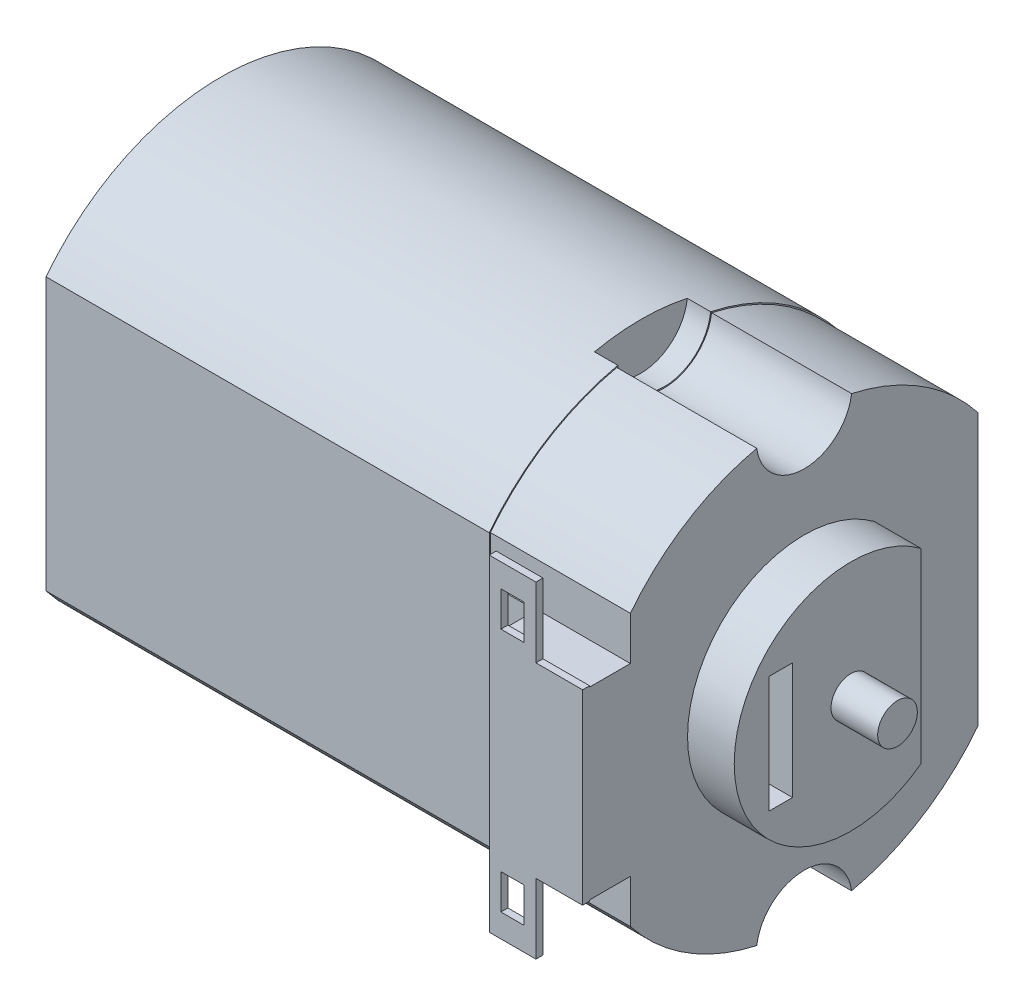
from build123d import *

# Parameters (mm, degrees)
BOSS_EXTRUDE1_DEPTH = 25
SKETCH2_R           = 2
CUT_EXTRUDE1_DEPTH  = 7
SKETCH3_W           = 1
SKETCH3_H           = 5
BOSS_EXTRUDE2_DEPTH = 2
SKETCH4_R           = 0.85
BOSS_EXTRUDE3_DEPTH = 2
SKETCH5_W           = 4
SKETCH5_H           = 8
BOSS_EXTRUDE4_DEPTH = 2
SKETCH6_W           = 2
SKETCH6_H           = 0.3
BOSS_EXTRUDE5_DEPTH = 3
SKETCH7_W           = 1
SKETCH7_H           = 1.5
CUT_EXTRUDE2_DEPTH  = 1
CUT_EXTRUDE3_START  = -6
CUT_EXTRUDE3_DEPTH  = 6


with BuildPart() as part:
    # Sketch1 → Boss-Extrude1 (new body)
    with BuildSketch(Plane(origin=(0, 0, 0), x_dir=(0, 0, -1), z_dir=(1, 0, 0))):
        with BuildLine():
            Line((-7.5, 5.830951895), (-7.5, -5.830951895))
            ThreePointArc((-7.5, -5.830951895), (0, -9.5), (7.5, -5.830951895))
            Line((7.5, -5.830951895), (7.5, 5.830951895))
            ThreePointArc((7.5, 5.830951895), (0, 9.5), (-7.5, 5.830951895))
        make_face()
    extrude(amount=BOSS_EXTRUDE1_DEPTH)

    # Sketch2 → Cut-Extrude1 (cut)
    with BuildSketch(Plane(origin=(25, 0, 0), x_dir=(0, 0, -1), z_dir=(1, 0, 0))):
        with Locations((0, 9.5)):
            Circle(SKETCH2_R)
        with Locations((0, -9.5)):
            Circle(SKETCH2_R)
    extrude(amount=-CUT_EXTRUDE1_DEPTH, mode=Mode.SUBTRACT)

    # Sketch3 → Boss-Extrude2 (add)
    with BuildSketch(Plane(origin=(25, 0, 0), x_dir=(0, 0, -1), z_dir=(1, 0, 0))):
        with BuildLine():
            Line((3, 4), (3, -4))
            ThreePointArc((3, -4), (-5, 0), (3, 4))
        make_face()
        with Locations((-3, 0)):
            Rectangle(SKETCH3_W, SKETCH3_H, mode=Mode.SUBTRACT)
    extrude(amount=BOSS_EXTRUDE2_DEPTH)

    # Sketch4 → Boss-Extrude3 (add)
    with BuildSketch(Plane(origin=(27, 0, 0), x_dir=(0, 0, -1), z_dir=(1, 0, 0))):
        Circle(SKETCH4_R)
    extrude(amount=BOSS_EXTRUDE3_DEPTH)

    # Sketch5 → Boss-Extrude4 (add)
    with BuildSketch(Plane.XY.offset(7.5)):
        with Locations((23, 0)):
            Rectangle(SKETCH5_W, SKETCH5_H)
    extrude(amount=BOSS_EXTRUDE4_DEPTH)

    # Sketch6 → Boss-Extrude5 (add)
    with BuildSketch(Plane.XZ.offset(4)):
        with Locations((22, 9.35)):
            Rectangle(SKETCH6_W, SKETCH6_H)
    boss_extrude5 = extrude(amount=BOSS_EXTRUDE5_DEPTH)

    # Mirror1: Boss-Extrude5 across plane
    add(boss_extrude5.mirror(Plane.ZX))

    # Sketch7 → Cut-Extrude2 (cut)
    with BuildSketch(Plane.XY.offset(9.5)):
        with Locations((22, -5.25)):
            Rectangle(SKETCH7_W, SKETCH7_H)
        with Locations((22, 5.25)):
            Rectangle(SKETCH7_W, SKETCH7_H)
    extrude(amount=-CUT_EXTRUDE2_DEPTH, mode=Mode.SUBTRACT)

    # Sketch8 → Cut-Extrude3 (cut)
    with BuildSketch(Plane(origin=(25, 0, 0), x_dir=(0, 0, -1), z_dir=(1, 0, 0)).offset(CUT_EXTRUDE3_START)):
        with BuildLine():
            Line((-7.45, 5.813776741), (-7.45, 3.95))
            Line((-7.45, 3.95), (-9.2, 3.95))
            Line((-9.2, 3.95), (-9.2, 4))
            Line((-9.2, 4), (-7.5, 4))
            Line((-7.5, 4), (-7.5, 5.830951895))
            ThreePointArc((-7.5, 5.830951895), (-5.049761967, 8.04673251), (-1.988888803, 9.289473684))
            ThreePointArc((-1.988888803, 9.289473684), (0, 7.5), (1.988888803, 9.289473684))
            ThreePointArc((1.988888803, 9.289473684), (5.049761967, 8.04673251), (7.5, 5.830951895))
            Line((7.5, 5.830951895), (7.5, -5.830951895))
            ThreePointArc((7.5, -5.830951895), (5.049761967, -8.04673251), (1.988888803, -9.289473684))
            ThreePointArc((1.988888803, -9.289473684), (0, -7.5), (-1.988888803, -9.289473684))
            ThreePointArc((-1.988888803, -9.289473684), (-5.049761967, -8.04673251), (-7.5, -5.830951895))
            Line((-7.5, -5.830951895), (-7.5, -4))
            Line((-7.5, -4), (-9.2, -4))
            Line((-9.2, -4), (-9.2, -3.95))
            Line((-9.2, -3.95), (-7.45, -3.95))
            Line((-7.45, -3.95), (-7.45, -5.813776741))
            ThreePointArc((-7.45, -5.813776741), (-5.039140418, -7.994345742), (-2.032001592, -9.228947368))
            ThreePointArc((-2.032001592, -9.228947368), (0, -7.45), (2.032001592, -9.228947368))
            ThreePointArc((2.032001592, -9.228947368), (5.039140418, -7.994345742), (7.45, -5.813776741))
            Line((7.45, -5.813776741), (7.45, 5.813776741))
            ThreePointArc((7.45, 5.813776741), (5.039140418, 7.994345742), (2.032001592, 9.228947368))
            ThreePointArc((2.032001592, 9.228947368), (0, 7.45), (-2.032001592, 9.228947368))
            ThreePointArc((-2.032001592, 9.228947368), (-5.039140418, 7.994345742), (-7.45, 5.813776741))
        make_face()
    extrude(amount=CUT_EXTRUDE3_DEPTH, mode=Mode.SUBTRACT)


solid = part.part
